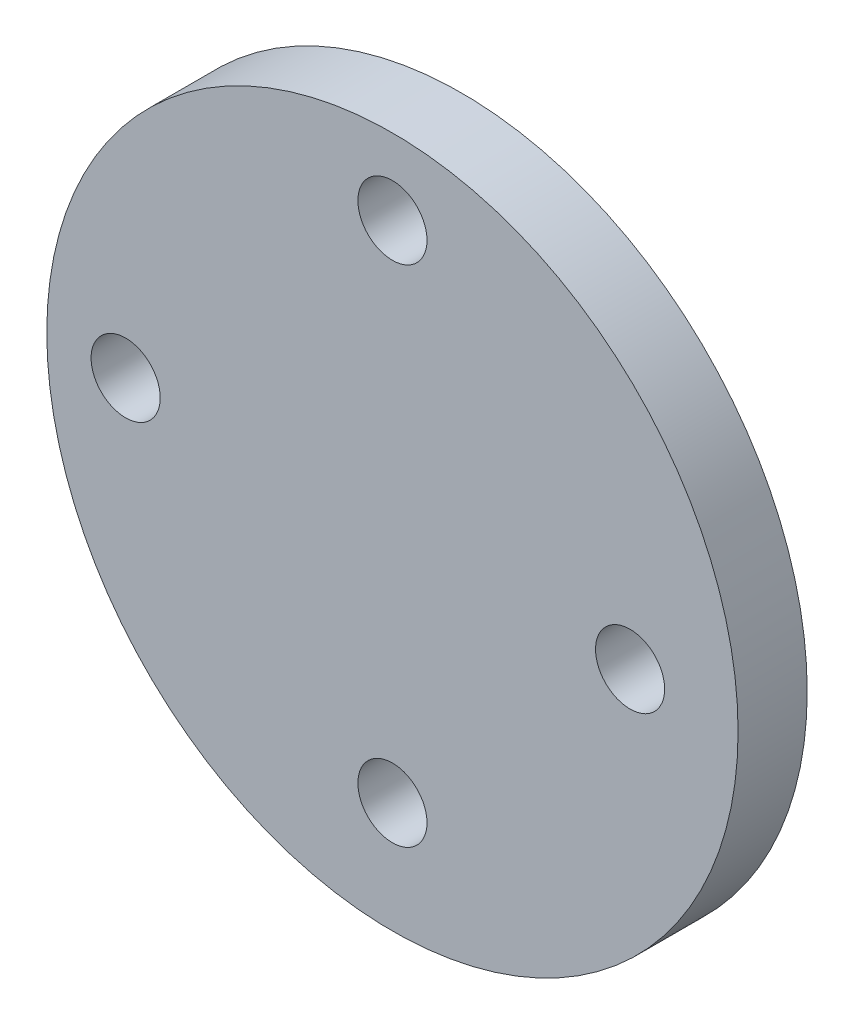
from build123d import *

# Parameters (mm, degrees)
SKETCH1_R           = 50
SKETCH1_R_2         = 5
BOSS_EXTRUDE1_DEPTH = 10


with BuildPart() as part:
    # Sketch1 → Boss-Extrude1 (new body)
    with BuildSketch(Plane.XY):
        Circle(SKETCH1_R)
        with Locations((0, 39.027729393)):
            Circle(SKETCH1_R_2, mode=Mode.SUBTRACT)
        with Locations((-38.591665377, 0)):
            Circle(SKETCH1_R_2, mode=Mode.SUBTRACT)
        with Locations((0, -33.940315878)):
            Circle(SKETCH1_R_2, mode=Mode.SUBTRACT)
        with Locations((34.376379894, 0)):
            Circle(SKETCH1_R_2, mode=Mode.SUBTRACT)
    extrude(amount=BOSS_EXTRUDE1_DEPTH)


solid = part.part
